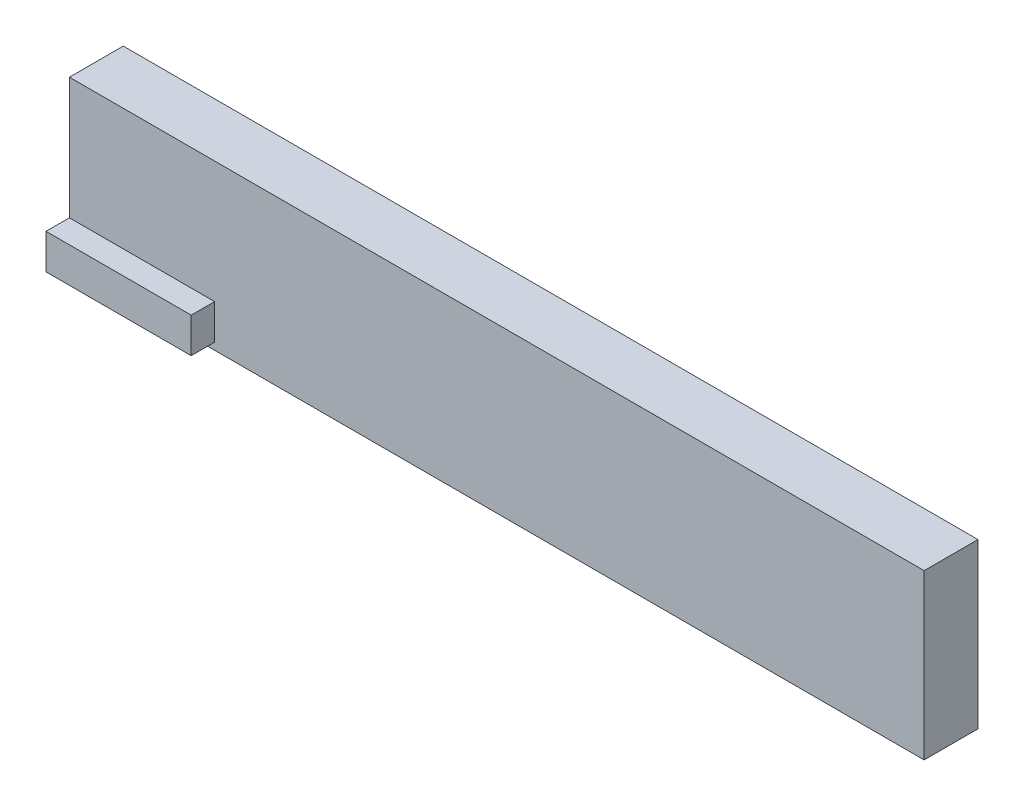
from build123d import *

# Parameters (mm, degrees)
SKETCH1_W           = 36.5
SKETCH1_H           = 7
BOSS_EXTRUDE1_DEPTH = 2.3
SKETCH2_W           = 6.2
SKETCH2_H           = 1.5
BOSS_EXTRUDE2_DEPTH = 1
SKETCH3_R           = 0.5
CUT_EXTRUDE1_DEPTH  = 1


with BuildPart() as part:
    # Sketch1 → Boss-Extrude1 (new body)
    with BuildSketch(Plane.XY):
        with Locations((18.25, -3.5)):
            Rectangle(SKETCH1_W, SKETCH1_H)
    extrude(amount=BOSS_EXTRUDE1_DEPTH)

    # Sketch2 → Boss-Extrude2 (add)
    with BuildSketch(Plane.XY.offset(2.3)):
        with Locations((3.1, -5.95)):
            Rectangle(SKETCH2_W, SKETCH2_H)
    extrude(amount=BOSS_EXTRUDE2_DEPTH)

    # Sketch3 → Cut-Extrude1 (cut)
    with BuildSketch(Plane.ZY):
        with Locations(Location((2.779912682, -5.934327953, 0), (0, 0, 270))):
            Circle(SKETCH3_R)
    extrude(amount=-CUT_EXTRUDE1_DEPTH, mode=Mode.SUBTRACT)


solid = part.part
